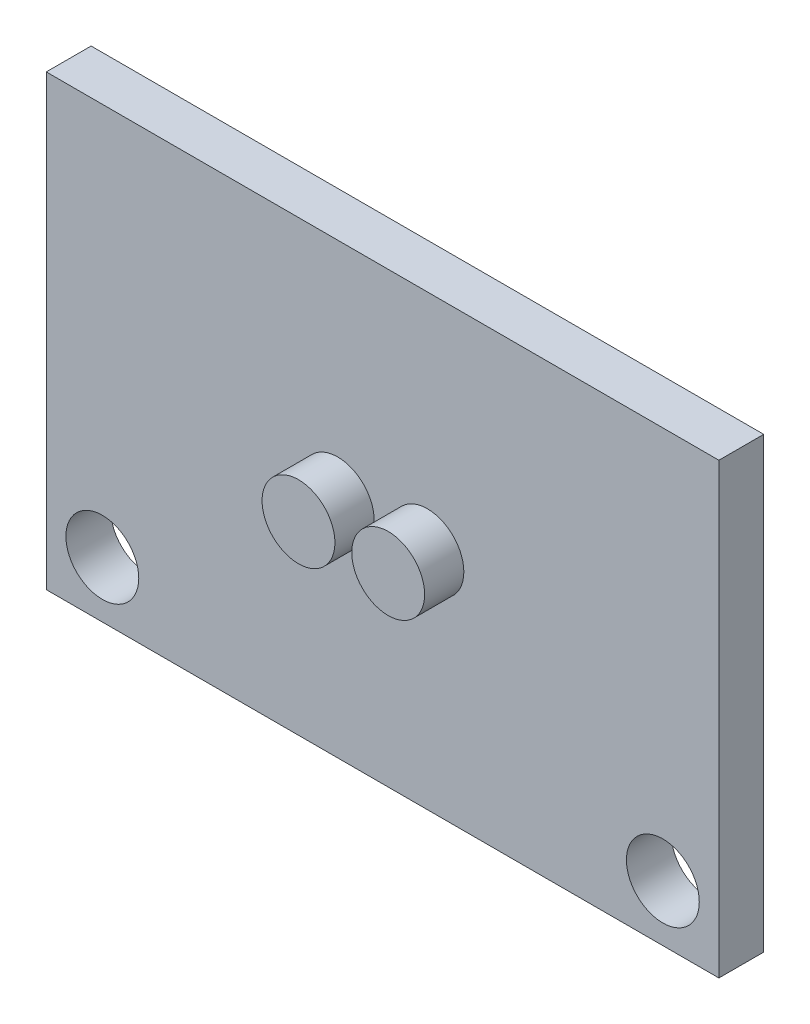
from build123d import *

# Parameters (mm, degrees)
SKETCH_3_W                                  = 24
SKETCH_3_H                                  = 16
V10_TOF_CANDIDATE_CARRIER24X16_DEPTH        = 1.6
V10_TOF_OPTICAL_PACKAGES_FACING_FRONT_START = 1.6
SKETCH_4_R                                  = 1.3
V10_TOF_OPTICAL_PACKAGES_FACING_FRONT_DEPTH = 1.4
SKETCH_5_R                                  = 1.3
V10_TOF_TWO_CANDIDATE_HOLES20MM_DEPTH       = 1.6


with BuildPart() as part:
    # 草图3 → V10_TOF_candidate_carrier24x16 (new body)
    with BuildSketch(Plane.XY):
        with Locations((0, 88)):
            Rectangle(SKETCH_3_W, SKETCH_3_H)
    extrude(amount=V10_TOF_CANDIDATE_CARRIER24X16_DEPTH)

    # 草图4 → V10_TOF_optical_packages_facing_front (add)
    with BuildSketch(Plane.XY.offset(V10_TOF_OPTICAL_PACKAGES_FACING_FRONT_START)):
        with Locations((-1.6, 88)):
            Circle(SKETCH_4_R)
        with Locations((1.6, 88)):
            Circle(SKETCH_4_R)
    extrude(amount=V10_TOF_OPTICAL_PACKAGES_FACING_FRONT_DEPTH)

    # 草图5 → V10_TOF_two_candidate_holes20mm (cut)
    with BuildSketch(Plane.XY.offset(1.6)):
        with Locations((-10, 82)):
            Circle(SKETCH_5_R)
        with Locations((10, 82)):
            Circle(SKETCH_5_R)
    extrude(amount=-V10_TOF_TWO_CANDIDATE_HOLES20MM_DEPTH, mode=Mode.SUBTRACT)


solid = part.part
